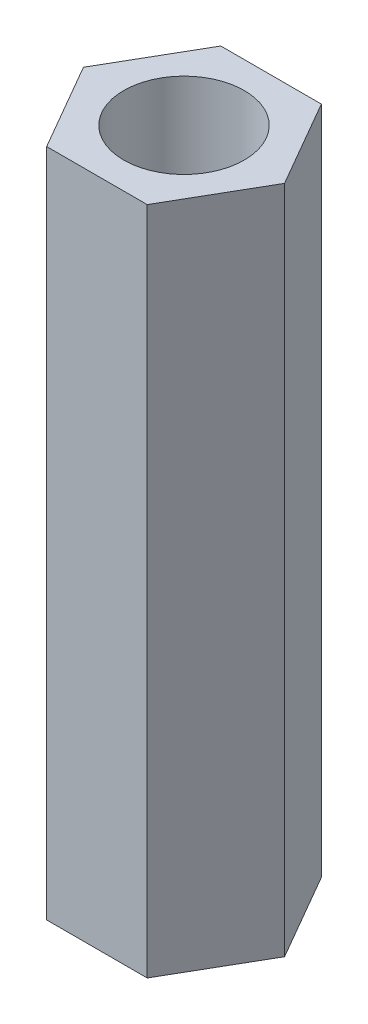
from build123d import *

# Parameters (mm, degrees)
SKETCH1_R           = 2.25
BOSS_EXTRUDE1_DEPTH = 12.5


with BuildPart() as part:
    # Sketch1 → Boss-Extrude1 (new, symmetric)
    with BuildSketch(Plane(origin=(0, 0, 0), x_dir=(1, 0, 0), z_dir=(0, 1, 0))):
        Polygon((1.876388375, 3.25), (-1.876388375, 3.25), (-3.75277675, 0), (-1.876388375, -3.25), (1.876388375, -3.25), (3.75277675, 0), align=None)
        with Locations(Location((0, 0, 0), (0, 0, 270))):
            Circle(SKETCH1_R, mode=Mode.SUBTRACT)
    extrude(amount=BOSS_EXTRUDE1_DEPTH, both=True)


solid = part.part
